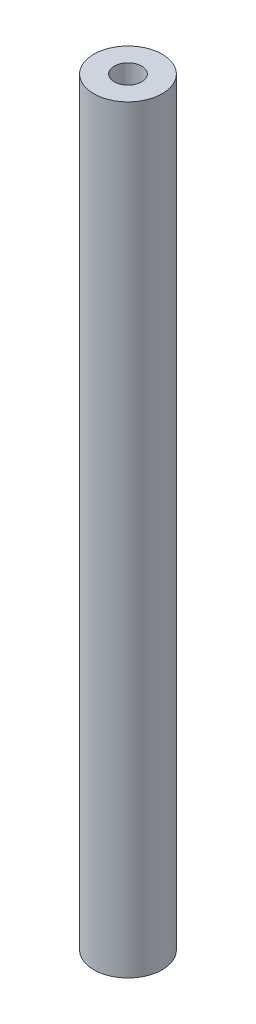
from build123d import *

# Parameters (mm, degrees)
SKETCH_1_R      = 2.5
SKETCH_1_R_2    = 1
EXTRUDE_1_DEPTH = 55.4


with BuildPart() as part:
    # 草图1 → 凸台-拉伸1 (new body)
    with BuildSketch(Plane(origin=(0, 0, 0), x_dir=(1, 0, 0), z_dir=(0, 1, 0))):
        with Locations(Location((0, 0, 0), (0, 0, 270))):
            Circle(SKETCH_1_R)
        with Locations(Location((0, 0, 0), (0, 0, 270))):
            Circle(SKETCH_1_R_2, mode=Mode.SUBTRACT)
    extrude(amount=EXTRUDE_1_DEPTH)


solid = part.part
